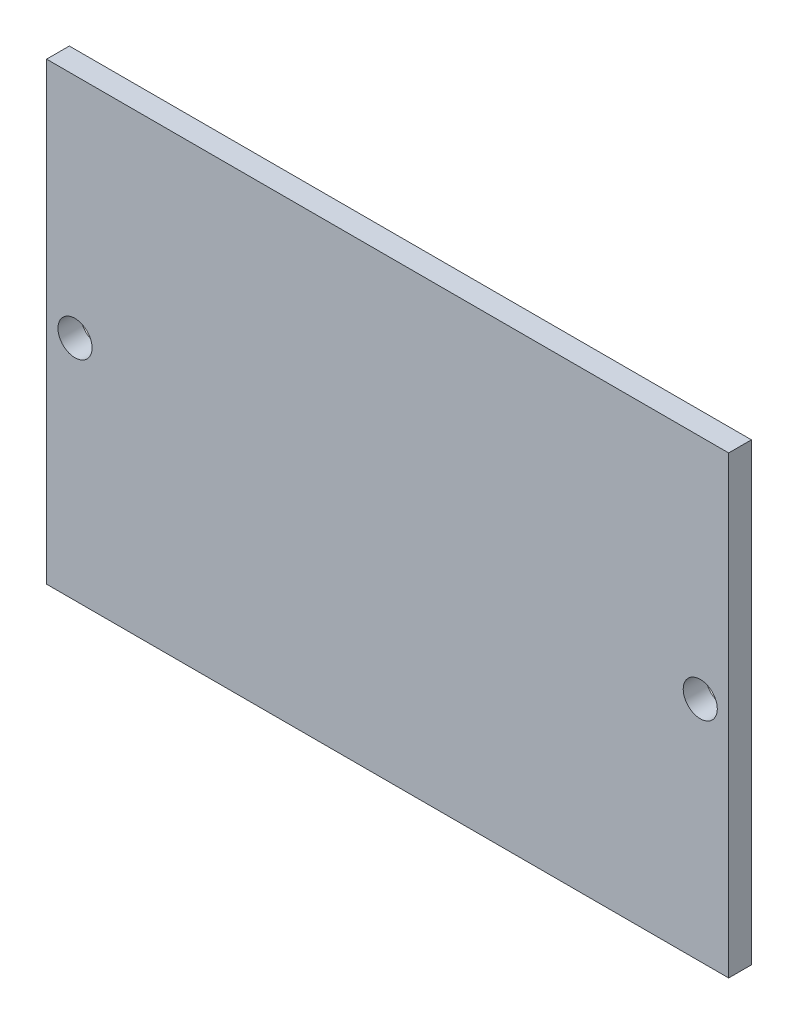
from build123d import *

# Parameters (mm, degrees)
SKETCH1_W           = 60
SKETCH1_H           = 40
BOSS_EXTRUDE1_DEPTH = 2
CUT_EXTRUDE1_REACH  = 38.111
SKETCH2_R           = 1.5


with BuildPart() as part:
    # Sketch1 → Boss-Extrude1 (new body)
    with BuildSketch(Plane.XY):
        Rectangle(SKETCH1_W, SKETCH1_H)
    extrude(amount=BOSS_EXTRUDE1_DEPTH)

    # Sketch2 → Cut-Extrude1 (cut, up to next)
    with BuildSketch(Plane(origin=(0, 0, 0), x_dir=(-1, 0, 0), z_dir=(0, 0, -1)), mode=Mode.PRIVATE) as cut_extrude1_sk1:
        with Locations((27.5, 0)):
            Circle(SKETCH2_R)
    cut_extrude1_tool1 = extrude(cut_extrude1_sk1.sketch, amount=-CUT_EXTRUDE1_REACH, mode=Mode.PRIVATE) & part.part
    # Sketch2 → Cut-Extrude1 (cut, up to next)
    with BuildSketch(Plane(origin=(0, 0, 0), x_dir=(-1, 0, 0), z_dir=(0, 0, -1)), mode=Mode.PRIVATE) as cut_extrude1_sk2:
        with Locations((-27.5, 0)):
            Circle(SKETCH2_R)
    cut_extrude1_tool2 = extrude(cut_extrude1_sk2.sketch, amount=-CUT_EXTRUDE1_REACH, mode=Mode.PRIVATE) & part.part
    add(cut_extrude1_tool1.solids().sort_by_distance((-27.5, 0, 0))[0], mode=Mode.SUBTRACT)
    add(cut_extrude1_tool2.solids().sort_by_distance((27.5, 0, 0))[0], mode=Mode.SUBTRACT)


solid = part.part
